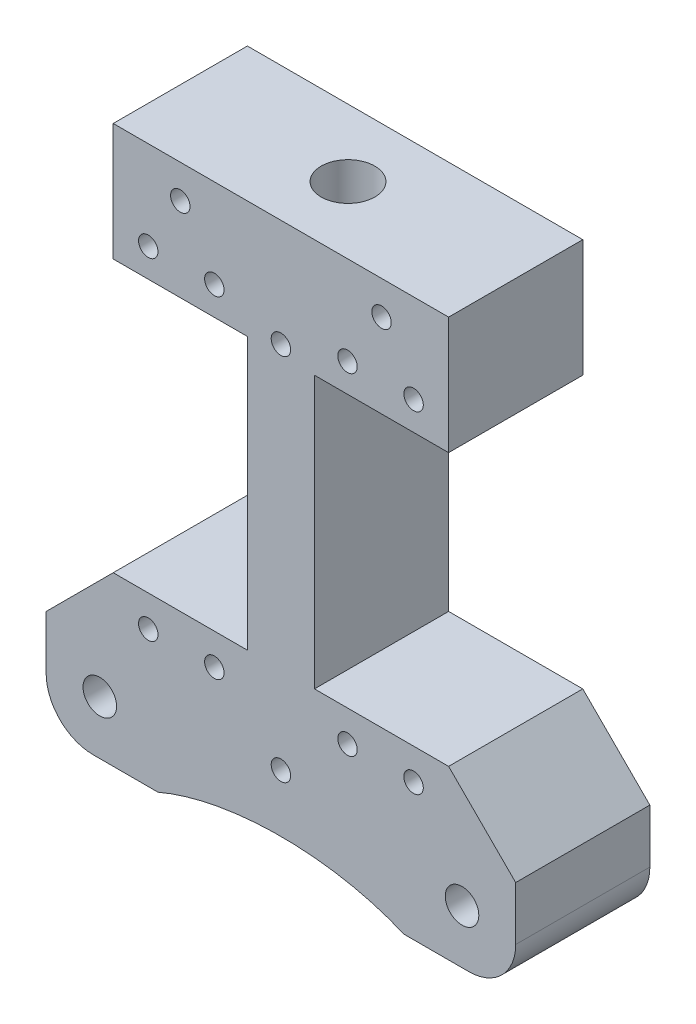
from build123d import *

# Parameters (mm, degrees)
SKETCH_1_W                = 50
SKETCH_1_H                = 80
EXTRUDE_1_DEPTH           = 20
CUT_EXTRUDE_1_DEPTH       = 18
CUT_EXTRUDE_1_DEPTH_BACK  = 48
SKETCH_2_W                = 40
SKETCH_2_H                = 40
CUT_EXTRUDE_2_DEPTH       = 25
CUT_EXTRUDE_2_DEPTH_BACK  = 50
SKETCH_3_R                = 1.45
SKETCH_5_W                = 20
SKETCH_5_H                = 20
EXTRUDE_3_DEPTH           = 10
SKETCH_6_W                = 20
SKETCH_6_H                = 20
EXTRUDE_4_DEPTH           = 10
SKETCH_11_W               = 70
SKETCH_11_H               = 5
EXTRUDE_6_DEPTH           = 20
SKETCH_12_R               = 2.5
CUT_EXTRUDE_6_DEPTH       = 26
CHAMFER_1_SIZE            = 10
SKETCH_14_W               = 25
SKETCH_14_H               = 15
EXTRUDE_7_DEPTH           = 20
CHAMFER_2_SIZE            = 3
CHAMFER_3_SIZE            = 2
CUT_EXTRUDE_8_DEPTH       = 30
CUT_EXTRUDE_8_DEPTH_BACK  = 57
SKETCH_17_R               = 1.45
SKETCH_18_W               = 26.067158979
SKETCH_18_H               = 13.506639349
CUT_EXTRUDE_9_DEPTH       = 42
SKETCH_19_RX              = 28.99919082
SKETCH_19_RY              = 15.360713199
CUT_EXTRUDE_10_DEPTH      = 42
FILLET_1_R                = 7
EXTRUDE_START             = -12
SKETCH_20_R               = 2.5
SKETCH_20_R_2             = 1.75
EXTRUDE_8_DEPTH           = 3.5
SKETCH_21_W               = 20
SKETCH_21_H               = 0.5
CUT_EXTRUDE_11_DEPTH      = 31
SKETCH_22_W               = 50
SKETCH_22_H               = 2
CUT_EXTRUDE_12_DEPTH      = 31
CUT_EXTRUDE_14_DEPTH      = 14
CUT_EXTRUDE_14_DEPTH_BACK = 53
SKETCH_24_R               = 1.45
SKETCH_25_R               = 1.45
CUT_EXTRUDE_16_DEPTH      = 26
SKETCH_26_R               = 4
CUT_EXTRUDE_17_DEPTH      = 10


with BuildPart() as part:
    # 草图1 → 凸台-拉伸1 (new body)
    with BuildSketch(Plane.XY):
        Rectangle(SKETCH_1_W, SKETCH_1_H)
    extrude(amount=EXTRUDE_1_DEPTH)

    # 草图2 → 切除-拉伸1 (cut, two sides: drawn at the far end of the back side and taken through both)
    with BuildSketch(Plane.XY.offset(20).offset(-CUT_EXTRUDE_1_DEPTH_BACK)):
        with Locations((-25, 0)):
            Rectangle(SKETCH_2_W, SKETCH_2_H)
        with Locations((25, 0)):
            Rectangle(SKETCH_2_W, SKETCH_2_H)
    extrude(amount=CUT_EXTRUDE_1_DEPTH + CUT_EXTRUDE_1_DEPTH_BACK, mode=Mode.SUBTRACT)

    # 草图3 → 切除-拉伸2 (cut, two sides: drawn at the far end of the back side and taken through both)
    with BuildSketch(Plane.XY.offset(20).offset(-CUT_EXTRUDE_2_DEPTH_BACK)):
        with Locations(Location((9.925, -24.661145618, 0), (0, 0, 180))):
            Circle(SKETCH_3_R)
        with Locations(Location((19.775, -24.661145618, 0), (0, 0, 180))):
            Circle(SKETCH_3_R)
        with Locations(Location((9.925, 24.761145618, 0), (0, 0, 180))):
            Circle(SKETCH_3_R)
        with Locations(Location((19.775, 24.761145618, 0), (0, 0, 180))):
            Circle(SKETCH_3_R)
        with Locations(Location((-9.925, 24.761145618, 0), (0, 0, 180))):
            Circle(SKETCH_3_R)
        with Locations(Location((-19.775, 24.761145618, 0), (0, 0, 180))):
            Circle(SKETCH_3_R)
        with Locations(Location((-9.925, -24.661145618, 0), (0, 0, 180))):
            Circle(SKETCH_3_R)
        with Locations(Location((-19.775, -24.661145618, 0), (0, 0, 180))):
            Circle(SKETCH_3_R)
    extrude(amount=CUT_EXTRUDE_2_DEPTH + CUT_EXTRUDE_2_DEPTH_BACK, mode=Mode.SUBTRACT)

    # 草图5 → 凸台-拉伸3 (add)
    with BuildSketch(Plane(origin=(25, 0, 0), x_dir=(0, 0, -1), z_dir=(1, 0, 0))):
        with Locations((-10, -30)):
            Rectangle(SKETCH_5_W, SKETCH_5_H)
    extrude(amount=EXTRUDE_3_DEPTH)

    # 草图6 → 凸台-拉伸4 (add)
    with BuildSketch(Plane.ZY.offset(25)):
        with Locations((10, -30)):
            Rectangle(SKETCH_6_W, SKETCH_6_H)
    extrude(amount=EXTRUDE_4_DEPTH)

    # 草图11 → 凸台-拉伸6 (add)
    with BuildSketch(Plane.XY.offset(20)):
        with Locations((0, -42.5)):
            Rectangle(SKETCH_11_W, SKETCH_11_H)
    extrude(amount=-EXTRUDE_6_DEPTH)

    # 草图12 → 切除-拉伸6 (cut)
    with BuildSketch(Plane.XY.offset(20)):
        with Locations((27, -37)):
            Circle(SKETCH_12_R)
        with Locations(Location((-27, -37, 0), (0, 0, 180))):
            Circle(SKETCH_12_R)
    extrude(amount=-CUT_EXTRUDE_6_DEPTH, mode=Mode.SUBTRACT)

    # 倒角1
    chamfer_1_edges = [part.edges().sort_by_distance(p)[0] for p in [
        (35, -20, 10),
        (-35, -20, 10),
    ]]
    chamfer(chamfer_1_edges, length=CHAMFER_1_SIZE)

    # 草图14 → 凸台-拉伸7 (add)
    with BuildSketch(Plane.XY.offset(20)):
        with Locations((0, -45)):
            Rectangle(SKETCH_14_W, SKETCH_14_H)
    extrude(amount=-EXTRUDE_7_DEPTH)

    # 倒角2
    chamfer_2_edges = [part.edges().sort_by_distance(p)[0] for p in [
        (12.5, -52.5, 10),
        (-12.5, -52.5, 10),
    ]]
    chamfer(chamfer_2_edges, length=CHAMFER_2_SIZE)

    # 倒角3
    chamfer_3_edges = [part.edges().sort_by_distance(p)[0] for p in [
        (0, -52.5, 0),
        (0, -52.5, 20),
    ]]
    chamfer(chamfer_3_edges, length=CHAMFER_3_SIZE)

    # 草图17 → 切除-拉伸8 (cut, two sides: drawn at the far end of the back side and taken through both)
    with BuildSketch(Plane(origin=(0, 0, 0), x_dir=(-1, 0, 0), z_dir=(0, 0, -1)).offset(-CUT_EXTRUDE_8_DEPTH_BACK)):
        with Locations((15, 33)):
            Circle(SKETCH_17_R)
        with Locations((-15, 33)):
            Circle(SKETCH_17_R)
    extrude(amount=CUT_EXTRUDE_8_DEPTH + CUT_EXTRUDE_8_DEPTH_BACK, mode=Mode.SUBTRACT)

    # 草图18 → 切除-拉伸9 (cut)
    with BuildSketch(Plane.XY.offset(20)):
        with Locations((-0.53357949, -51.753319675)):
            Rectangle(SKETCH_18_W, SKETCH_18_H)
    extrude(amount=-CUT_EXTRUDE_9_DEPTH, mode=Mode.SUBTRACT)

    # 草图19 → 切除-拉伸10 (cut)
    with BuildSketch(Plane.XY.offset(20)):
        with Locations(Location((0, -56.905793797), (0, 0, 0))):
            Ellipse(SKETCH_19_RX, SKETCH_19_RY)
    extrude(amount=-CUT_EXTRUDE_10_DEPTH, mode=Mode.SUBTRACT)

    # 圆角1
    fillet_1_edges = [part.edges().sort_by_distance(p)[0] for p in [
        (-35, -45, 10),
        (35, -45, 10),
    ]]
    fillet(fillet_1_edges, radius=FILLET_1_R)

    # 草图20 → 凸台-拉伸8 (add)
    # profile 1 of 2: a face of its own
    with BuildSketch(Plane(origin=(0, 0, 0), x_dir=(-1, 0, 0), z_dir=(0, 0, -1)).offset(EXTRUDE_START)):
        with Locations((27, -37)):
            Circle(SKETCH_20_R)
        with Locations((27, -37)):
            Circle(SKETCH_20_R_2, mode=Mode.SUBTRACT)
    # profile 2 of 2: a face of its own
    with BuildSketch(Plane(origin=(0, 0, 0), x_dir=(-1, 0, 0), z_dir=(0, 0, -1)).offset(EXTRUDE_START)):
        with Locations(Location((-27, -37, 0), (0, 0, 180))):
            Circle(SKETCH_20_R)
        with Locations((-27, -37)):
            Circle(SKETCH_20_R_2, mode=Mode.SUBTRACT)
    extrude(amount=EXTRUDE_8_DEPTH)

    # 草图21 → 切除-拉伸11 (cut)
    with BuildSketch(Plane(origin=(0, 0, 0), x_dir=(-1, 0, 0), z_dir=(0, 0, -1))):
        with Locations((-15, 20.25)):
            Rectangle(SKETCH_21_W, SKETCH_21_H)
        with Locations((15, 20.25)):
            Rectangle(SKETCH_21_W, SKETCH_21_H)
    extrude(amount=-CUT_EXTRUDE_11_DEPTH, mode=Mode.SUBTRACT)

    # 草图22 → 切除-拉伸12 (cut)
    with BuildSketch(Plane(origin=(0, 0, 0), x_dir=(-1, 0, 0), z_dir=(0, 0, -1))):
        with Locations((0, 39)):
            Rectangle(SKETCH_22_W, SKETCH_22_H)
    extrude(amount=-CUT_EXTRUDE_12_DEPTH, mode=Mode.SUBTRACT)

    # 草图24 → 切除-拉伸14 (cut, two sides: drawn at the far end of the back side and taken through both)
    with BuildSketch(Plane(origin=(0, 0, 0), x_dir=(-1, 0, 0), z_dir=(0, 0, -1)).offset(-CUT_EXTRUDE_14_DEPTH_BACK)):
        with Locations((0, -33)):
            Circle(SKETCH_24_R)
    extrude(amount=CUT_EXTRUDE_14_DEPTH + CUT_EXTRUDE_14_DEPTH_BACK, mode=Mode.SUBTRACT)

    # 草图25 → 切除-拉伸16 (cut)
    with BuildSketch(Plane(origin=(0, 0, 0), x_dir=(-1, 0, 0), z_dir=(0, 0, -1))):
        with Locations((0, 22)):
            Circle(SKETCH_25_R)
    extrude(amount=-CUT_EXTRUDE_16_DEPTH, mode=Mode.SUBTRACT)

    # 草图26 → 切除-拉伸17 (cut)
    with BuildSketch(Plane(origin=(0, 38, 0), x_dir=(1, 0, 0), z_dir=(0, 1, 0))):
        with Locations(Location((0, -10, 0), (0, 0, 270))):
            Circle(SKETCH_26_R)
    extrude(amount=-CUT_EXTRUDE_17_DEPTH, mode=Mode.SUBTRACT)


solid = part.part
